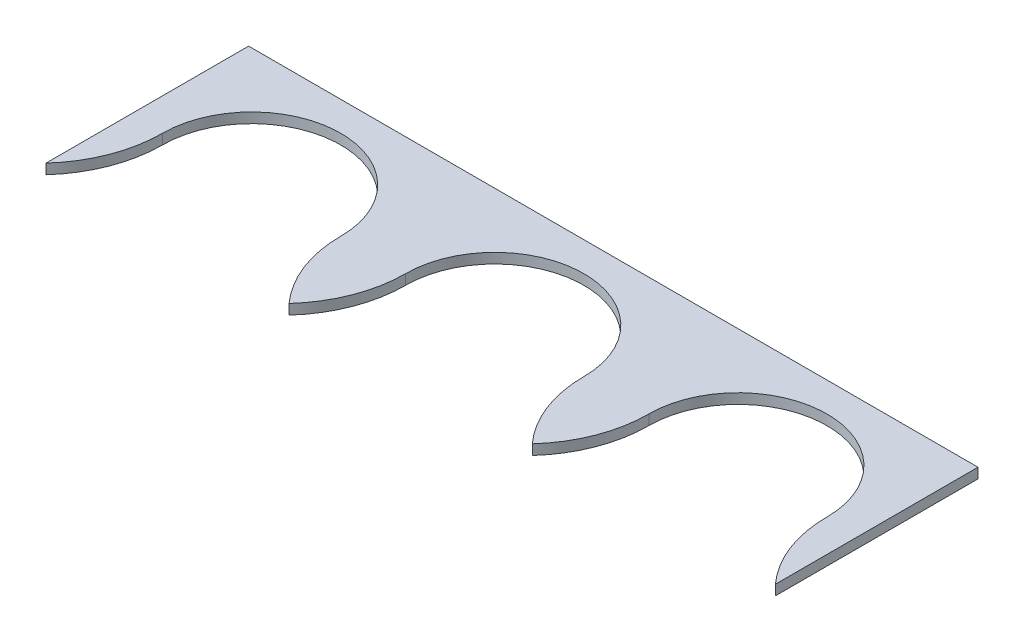
from build123d import *

# Parameters (mm, degrees)
BOSS_EXTRUDE1_DEPTH = 6.35


with BuildPart() as part:
    # Sketch1 → Boss-Extrude1 (new body)
    with BuildSketch(Plane(origin=(0, 0, 0), x_dir=(1, 0, 0), z_dir=(0, 1, 0))):
        with BuildLine():
            ThreePointArc((11.585828754, -34.373994235), (16.841756292, -62.617220967), (31.905828754, -87.078994235))
            Line((31.905828754, -87.078994235), (31.905828754, 39.921005765))
            Line((31.905828754, 39.921005765), (-120.494171246, 39.921005765))
            Line((-120.494171246, 39.921005765), (-120.494171246, -87.078994235))
            ThreePointArc((-120.494171246, -87.078994235), (-105.430098785, -62.617220967), (-100.174171246, -34.373994235))
            ThreePointArc((-100.174171246, -34.373994235), (-44.294171246, 21.506005765), (11.585828754, -34.373994235))
        make_face()
        with BuildLine():
            Line((31.905828754, 39.921005765), (31.905828754, -87.078994235))
            ThreePointArc((31.905828754, -87.078994235), (46.969901215, -62.617220967), (52.225828754, -34.373994235))
            ThreePointArc((52.225828754, -34.373994235), (108.105828754, 21.506005765), (163.985828754, -34.373994235))
            ThreePointArc((163.985828754, -34.373994235), (169.241756292, -62.617220967), (184.305828754, -87.078994235))
            Line((184.305828754, -87.078994235), (184.305828754, 39.921005765))
            Line((184.305828754, 39.921005765), (31.905828754, 39.921005765))
        make_face()
        with BuildLine():
            Line((336.705828754, 39.921005765), (184.305828754, 39.921005765))
            Line((184.305828754, 39.921005765), (184.305828754, -87.078994235))
            ThreePointArc((184.305828754, -87.078994235), (199.369901215, -62.617220967), (204.625828754, -34.373994235))
            ThreePointArc((204.625828754, -34.373994235), (260.505828754, 21.506005765), (316.385828754, -34.373994235))
            ThreePointArc((316.385828754, -34.373994235), (321.641756292, -62.617220967), (336.705828754, -87.078994235))
            Line((336.705828754, -87.078994235), (336.705828754, 39.921005765))
        make_face()
    extrude(amount=-BOSS_EXTRUDE1_DEPTH)


solid = part.part
